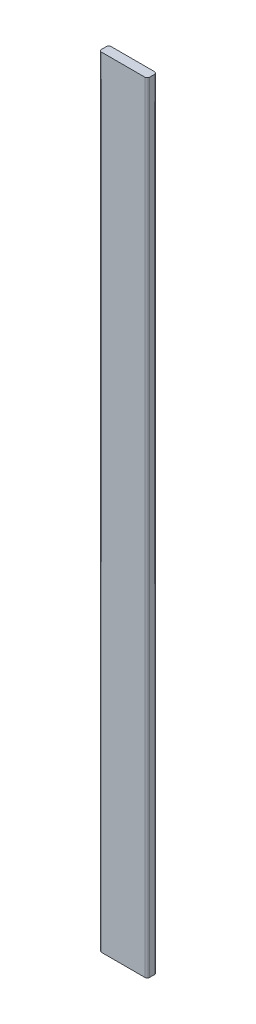
from build123d import *

# Parameters (mm, degrees)
SKETCH_1_W      = 100
SKETCH_1_H      = 1620
EXTRUDE_1_DEPTH = 20
FILLET_1_R      = 5


with BuildPart() as part:
    # Эскиз1 → Бобышка-Вытянуть1 (new body)
    with BuildSketch(Plane.XY):
        with Locations((-331.578947368, 737.631578947)):
            Rectangle(SKETCH_1_W, SKETCH_1_H)
    extrude(amount=EXTRUDE_1_DEPTH)

    # Скругление1
    fillet_1_edges = [part.edges().sort_by_distance(p)[0] for p in [
        (-281.578947368, 737.631578947, 20),
        (-381.578947368, 737.631578947, 20),
        (-281.578947368, 737.631578947, 0),
        (-381.578947368, 737.631578947, 0),
    ]]
    fillet(fillet_1_edges, radius=FILLET_1_R)


solid = part.part
